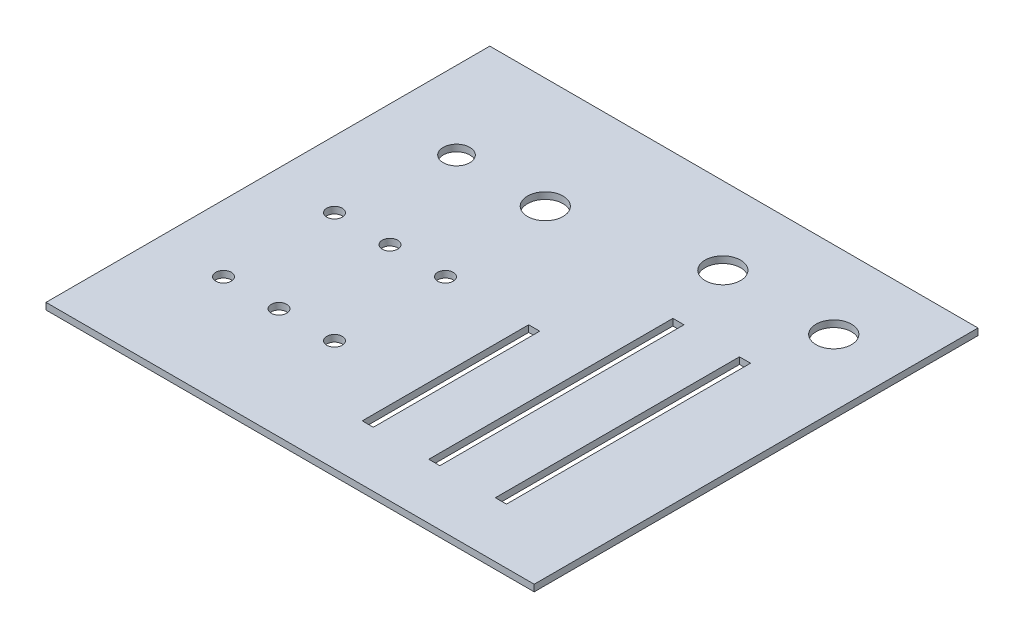
from build123d import *

# Parameters (mm, degrees)
ESBO_O2_W                = 220
ESBO_O2_H                = 200
RESSALTO_EXTRUS_O1_DEPTH = 3
ESBO_O3_R                = 3.5
ESBO_O3_R_2              = 6
ESBO_O3_R_3              = 8
ESBO_O3_W                = 5
ESBO_O3_H                = 110
ESBO_O3_H_2              = 75
CORTE_EXTRUS_O1_DEPTH    = 149.690954668


with BuildPart() as part:
    # Esboço2 → Ressalto-extrusão1 (new body)
    with BuildSketch(Plane(origin=(0, 0, 0), x_dir=(1, 0, 0), z_dir=(0, 1, 0))):
        Rectangle(ESBO_O2_W, ESBO_O2_H)
    extrude(amount=RESSALTO_EXTRUS_O1_DEPTH)

    # Esboço3 → Corte-extrusão1 (cut, through all)
    with BuildSketch(Plane(origin=(0, 3, 0), x_dir=(1, 0, 0), z_dir=(0, 1, 0))):
        with Locations(Location((-80, 0, 0), (0, 0, 270))):
            Circle(ESBO_O3_R)
        with Locations(Location((-55, 0, 0), (0, 0, 270))):
            Circle(ESBO_O3_R)
        with Locations(Location((-30, 0, 0), (0, 0, 270))):
            Circle(ESBO_O3_R)
        with Locations(Location((-80, -50, 0), (0, 0, 270))):
            Circle(ESBO_O3_R)
        with Locations(Location((-55, -50, 0), (0, 0, 270))):
            Circle(ESBO_O3_R)
        with Locations(Location((-30, -50, 0), (0, 0, 270))):
            Circle(ESBO_O3_R)
        with Locations(Location((-75, 50, 0), (0, 0, 270))):
            Circle(ESBO_O3_R_2)
        with Locations(Location((-35, 50, 0), (0, 0, 270))):
            Circle(ESBO_O3_R_3)
        with Locations(Location((30, 65, 0), (0, 0, 270))):
            Circle(ESBO_O3_R_3)
        with Locations(Location((80, 65, 0), (0, 0, 270))):
            Circle(ESBO_O3_R_3)
        with Locations((70, -20)):
            Rectangle(ESBO_O3_W, ESBO_O3_H)
        with Locations((40, -20)):
            Rectangle(ESBO_O3_W, ESBO_O3_H)
        with Locations((10, -37.5)):
            Rectangle(ESBO_O3_W, ESBO_O3_H_2)
    extrude(amount=-CORTE_EXTRUS_O1_DEPTH, mode=Mode.SUBTRACT)


solid = part.part
